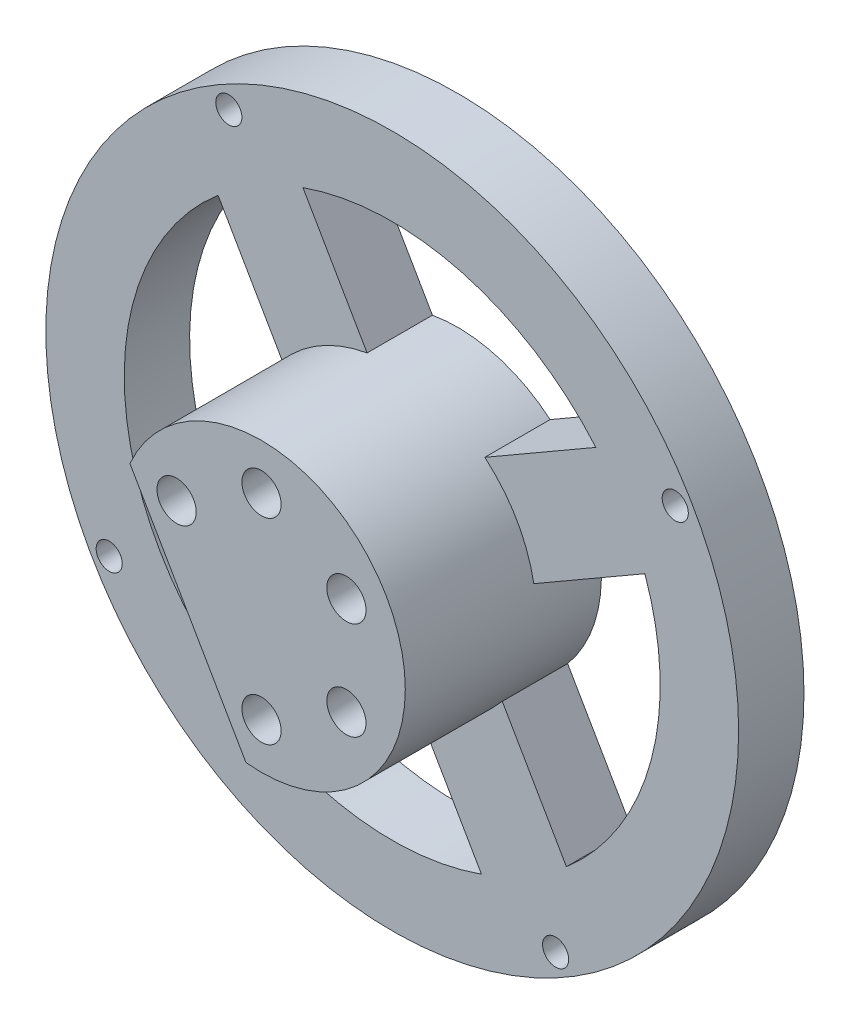
from build123d import *
from build123d.topology import SkipClean

# Parameters (mm, degrees)
ESQUISSE2_R             = 53
ESQUISSE2_R_2           = 3
BOSS_EXTRU_1_DEPTH      = 10
ESQUISSE3_R             = 22
ESQUISSE3_R_2           = 3
BOSS_EXTRU_2_DEPTH      = 20
ENL_V_MAT_EXTRU_1_DEPTH = 6
ENL_V_MAT_EXTRU_2_DEPTH = 81.734131568
ESQUISSE7_R             = 2
ENL_V_MAT_EXTRU_3_DEPTH = 81.734131568


with BuildPart() as part:
    # Esquisse2 → Boss.-Extru.1 (new body)
    with BuildSketch(Plane.XY):
        Circle(ESQUISSE2_R)
        with Locations((0, -15)):
            Circle(ESQUISSE2_R_2, mode=Mode.SUBTRACT)
        with Locations((12.990381057, -7.5)):
            Circle(ESQUISSE2_R_2, mode=Mode.SUBTRACT)
        with Locations((12.990381057, 7.5)):
            Circle(ESQUISSE2_R_2, mode=Mode.SUBTRACT)
        with Locations((0, 15)):
            Circle(ESQUISSE2_R_2, mode=Mode.SUBTRACT)
        with Locations((-12.990381057, 7.5)):
            Circle(ESQUISSE2_R_2, mode=Mode.SUBTRACT)
        with BuildLine():
            Line((-26.649284405, 31.157914575), (-16.836249468, 14.161239488))
            ThreePointArc((-16.836249468, 14.161239488), (-21.250368178, 5.694018992), (-21.661239488, -3.845868412))
            Line((-21.661239488, -3.845868412), (-38.657914575, -13.658903349))
            ThreePointArc((-38.657914575, -13.658903349), (-39.602958878, 10.611580849), (-26.649284405, 31.157914575))
        make_face(mode=Mode.SUBTRACT)
        with BuildLine():
            Line((-13.658903349, 38.657914575), (-3.845868412, 21.661239488))
            ThreePointArc((-3.845868412, 21.661239488), (5.694018992, 21.250368178), (14.161239488, 16.836249468))
            Line((14.161239488, 16.836249468), (31.157914575, 26.649284405))
            ThreePointArc((31.157914575, 26.649284405), (10.611580849, 39.602958878), (-13.658903349, 38.657914575))
        make_face(mode=Mode.SUBTRACT)
        with BuildLine():
            Line((38.657914575, 13.658903349), (21.661239488, 3.845868412))
            ThreePointArc((21.661239488, 3.845868412), (21.250368178, -5.694018992), (16.836249468, -14.161239488))
            Line((16.836249468, -14.161239488), (26.649284405, -31.157914575))
            ThreePointArc((26.649284405, -31.157914575), (39.602958878, -10.611580849), (38.657914575, 13.658903349))
        make_face(mode=Mode.SUBTRACT)
        with BuildLine():
            Line((13.658903349, -38.657914575), (3.845868412, -21.661239488))
            ThreePointArc((3.845868412, -21.661239488), (-5.694018992, -21.250368178), (-14.161239488, -16.836249468))
            Line((-14.161239488, -16.836249468), (-31.157914575, -26.649284405))
            ThreePointArc((-31.157914575, -26.649284405), (-10.611580849, -39.602958878), (13.658903349, -38.657914575))
        make_face(mode=Mode.SUBTRACT)
    extrude(amount=BOSS_EXTRU_1_DEPTH)

    # Esquisse3 → Boss.-Extru.2 (add)
    with BuildSketch(Plane.XY.offset(10)):
        with Locations(Location((0, 0, 0), (0, 0, 190.067729528))):
            Circle(ESQUISSE3_R)
        with Locations((-12.990381057, 7.5)):
            Circle(ESQUISSE3_R_2, mode=Mode.SUBTRACT)
        with Locations((0, 15)):
            Circle(ESQUISSE3_R_2, mode=Mode.SUBTRACT)
        with Locations((12.990381057, 7.5)):
            Circle(ESQUISSE3_R_2, mode=Mode.SUBTRACT)
        with Locations((12.990381057, -7.5)):
            Circle(ESQUISSE3_R_2, mode=Mode.SUBTRACT)
        with Locations((0, -15)):
            Circle(ESQUISSE3_R_2, mode=Mode.SUBTRACT)
    extrude(amount=BOSS_EXTRU_2_DEPTH)

    # Esquisse4 → Enlèv. mat.-Extru.1 (cut)
    with BuildSketch(Plane(origin=(0, 0, 0), x_dir=(-1, 0, 0), z_dir=(0, 0, -1))):
        Polygon((15.877132403, 2.5), (18.763883749, 7.5), (15.877132403, 12.5), (10.103629711, 12.5), (7.216878365, 7.5), (10.103629711, 2.5), align=None)
        Polygon((-2.886751346, 20), (-5.773502692, 15), (-2.886751346, 10), (2.886751346, 10), (5.773502692, 15), (2.886751346, 20), align=None)
        Polygon((-18.763883749, 7.5), (-15.877132403, 2.5), (-10.103629711, 2.5), (-7.216878365, 7.5), (-10.103629711, 12.5), (-15.877132403, 12.5), align=None)
        Polygon((-15.877132403, -12.5), (-10.103629711, -12.5), (-7.216878365, -7.5), (-10.103629711, -2.5), (-15.877132403, -2.5), (-18.763883749, -7.5), align=None)
        Polygon((2.886751346, -20), (5.773502692, -15), (2.886751346, -10), (-2.886751346, -10), (-5.773502692, -15), (-2.886751346, -20), align=None)
    extrude(amount=-ENL_V_MAT_EXTRU_1_DEPTH, mode=Mode.SUBTRACT)

    # Esquisse5 → Enlèv. mat.-Extru.2 (cut, through all)
    with SkipClean():  # the faces are left unmerged after this step: merging them gives an invalid solid
        with BuildSketch(Plane(origin=(0, 0, 0), x_dir=(-1, 0, 0), z_dir=(0, 0, -1))):
            with BuildLine():
                Line((2.384210575, -21.870426149), (20.132449924, 8.870426149))
                Line((20.132449924, 8.870426149), (38.657914575, -13.658903349))
                ThreePointArc((38.657914575, -13.658903349), (35.507041555, -20.5), (31.157914575, -26.649284405))
                Line((31.157914575, -26.649284405), (2.384210575, -21.870426149))
            make_face()
        extrude(amount=-ENL_V_MAT_EXTRU_2_DEPTH, mode=Mode.SUBTRACT)

    # Esquisse7 → Enlèv. mat.-Extru.3 (cut, through all)
    with SkipClean():  # the faces are left unmerged after this step: merging them gives an invalid solid
        with BuildSketch(Plane(origin=(0, 0, 0), x_dir=(-1, 0, 0), z_dir=(0, 0, -1))):
            with Locations((-43.301270189, 25)):
                Circle(ESQUISSE7_R)
            with Locations((25, 43.301270189)):
                Circle(ESQUISSE7_R)
            with Locations((43.301270189, -25)):
                Circle(ESQUISSE7_R)
            with Locations((-25, -43.301270189)):
                Circle(ESQUISSE7_R)
        extrude(amount=-ENL_V_MAT_EXTRU_3_DEPTH, mode=Mode.SUBTRACT)


solid = part.part
